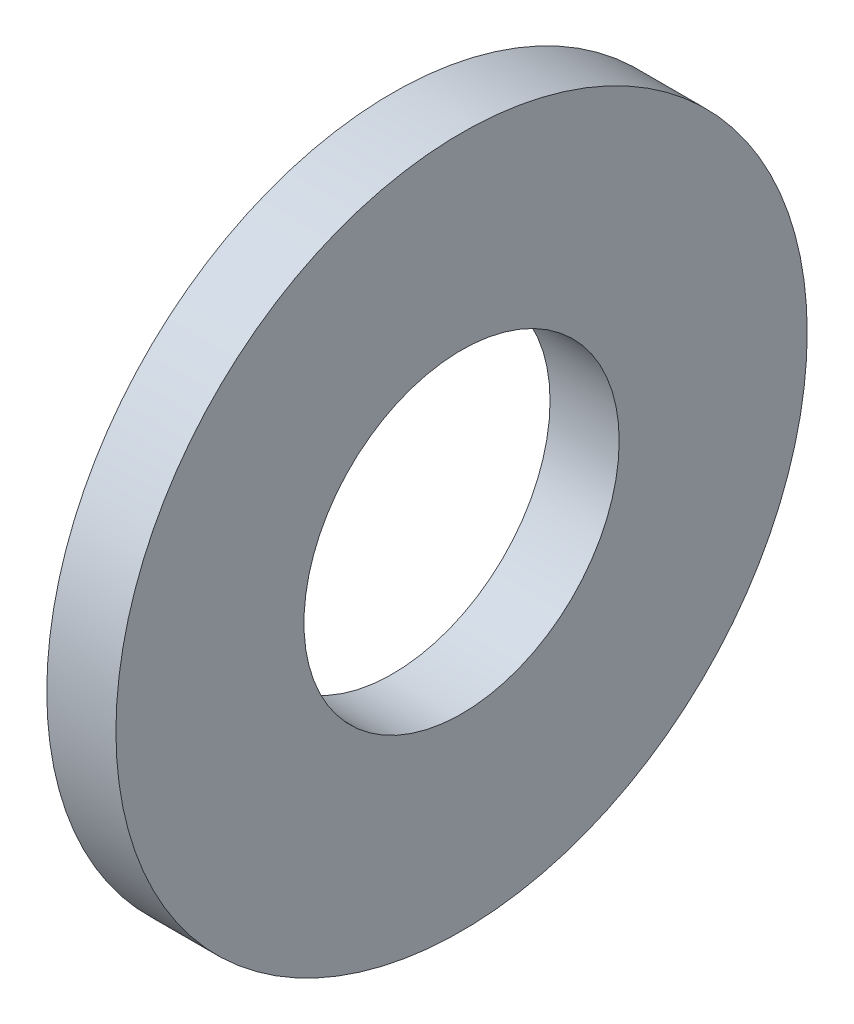
from build123d import *

# Parameters (mm, degrees)
SKETCH1_R           = 6.35
SKETCH1_R_2         = 2.8956
BOSS_EXTRUDE1_DEPTH = 1.27


with BuildPart() as part:
    # Sketch1 → Boss-Extrude1 (new body)
    with BuildSketch(Plane(origin=(0, 0, 0), x_dir=(0, 0, -1), z_dir=(1, 0, 0))):
        Circle(SKETCH1_R)
        Circle(SKETCH1_R_2, mode=Mode.SUBTRACT)
    extrude(amount=BOSS_EXTRUDE1_DEPTH)


solid = part.part
